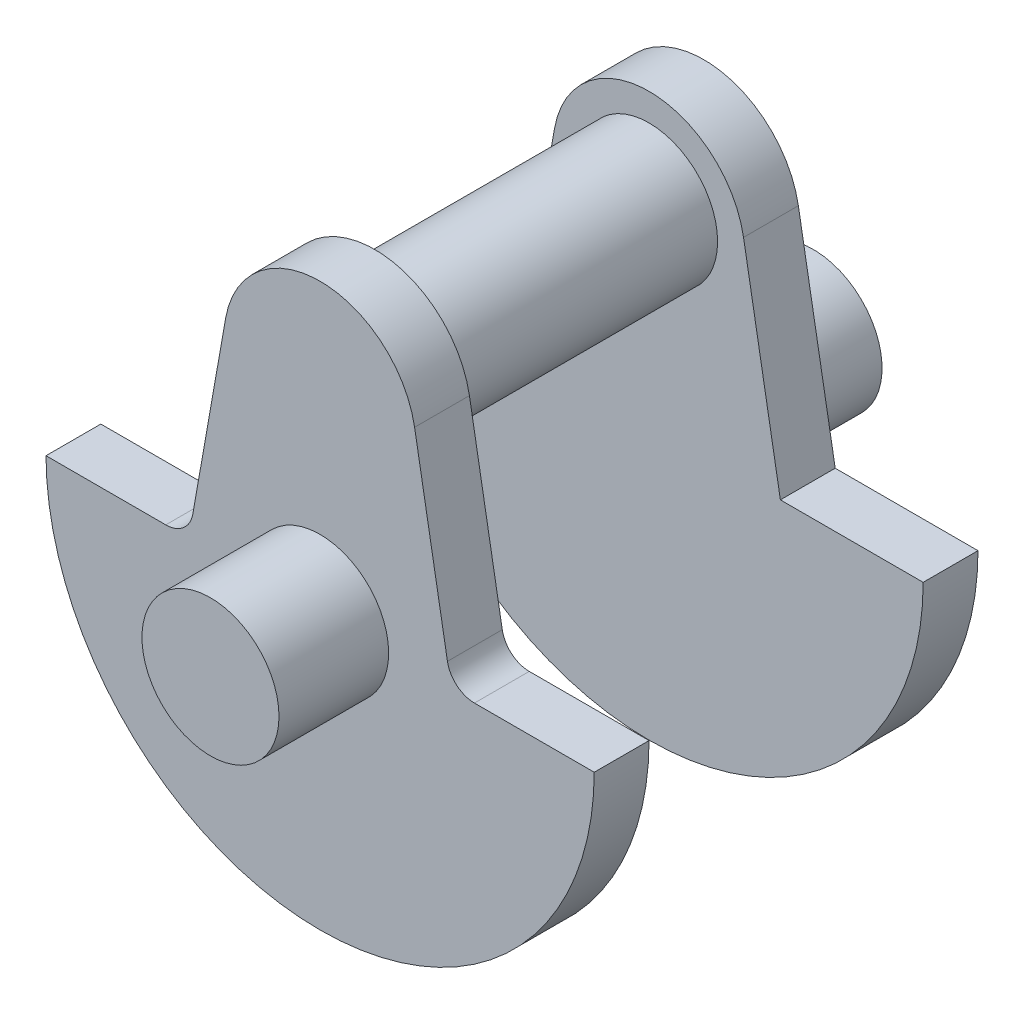
from build123d import *

# Parameters (mm, degrees)
SKETCH2_R           = 12.5
BOSS_EXTRUDE1_DEPTH = 20
BOSS_EXTRUDE2_DEPTH = 10
FILLET1_R           = 5
SKETCH4_R           = 12.5
BOSS_EXTRUDE3_DEPTH = 50
BOSS_EXTRUDE4_START = 20
SKETCH5_R           = 12.5
BOSS_EXTRUDE4_DEPTH = 20


with BuildPart() as part:
    # Sketch2 → Boss-Extrude1 (new body)
    with BuildSketch(Plane.XY):
        Circle(SKETCH2_R)
    extrude(amount=BOSS_EXTRUDE1_DEPTH)

    # Sketch3 → Boss-Extrude2 (add)
    with BuildSketch(Plane.XY):
        with BuildLine():
            Line((-49.999953659, -0.068074118), (-23.953413336, -0.068074118))
            Line((-23.953413336, -0.068074118), (-17.234135678, 38.038843109))
            ThreePointArc((-17.234135678, 38.038843109), (0, 52.5), (17.234135678, 38.038843109))
            Line((17.234135678, 38.038843109), (23.953413336, -0.068074118))
            Line((23.953413336, -0.068074118), (49.999953659, -0.068074118))
            ThreePointArc((49.999953659, -0.068074118), (0, -50), (-49.999953659, -0.068074118))
        make_face()
    boss_extrude2 = extrude(amount=-BOSS_EXTRUDE2_DEPTH)

    # Fillet1
    fillet1_edges = [part.edges().sort_by_distance(p)[0] for p in [
        (-23.953413336, -0.068074118, -5),
        (23.953413336, -0.068074118, -5),
    ]]
    fillet(fillet1_edges, radius=FILLET1_R)

    # Sketch4 → Boss-Extrude3 (add)
    with BuildSketch(Plane(origin=(0, 0, -10), x_dir=(-1, 0, 0), z_dir=(0, 0, -1))):
        with Locations(Location((0, 35, 0), (0, 0, 180))):
            Circle(SKETCH4_R)
    extrude(amount=BOSS_EXTRUDE3_DEPTH)

    # Mirror1: Boss-Extrude2 across plane
    add(boss_extrude2.mirror(Plane(origin=(0, 0, -35), x_dir=(1, 0, 0), z_dir=(0, 0, -1))))

    # Sketch5 → Boss-Extrude4 (add)
    with BuildSketch(Plane(origin=(0, 0, -70), x_dir=(-1, 0, 0), z_dir=(0, 0, -1)).offset(BOSS_EXTRUDE4_START)):
        with Locations(Location((0, 0, 0), (0, 0, 180))):
            Circle(SKETCH5_R)
    extrude(amount=-BOSS_EXTRUDE4_DEPTH)


solid = part.part
